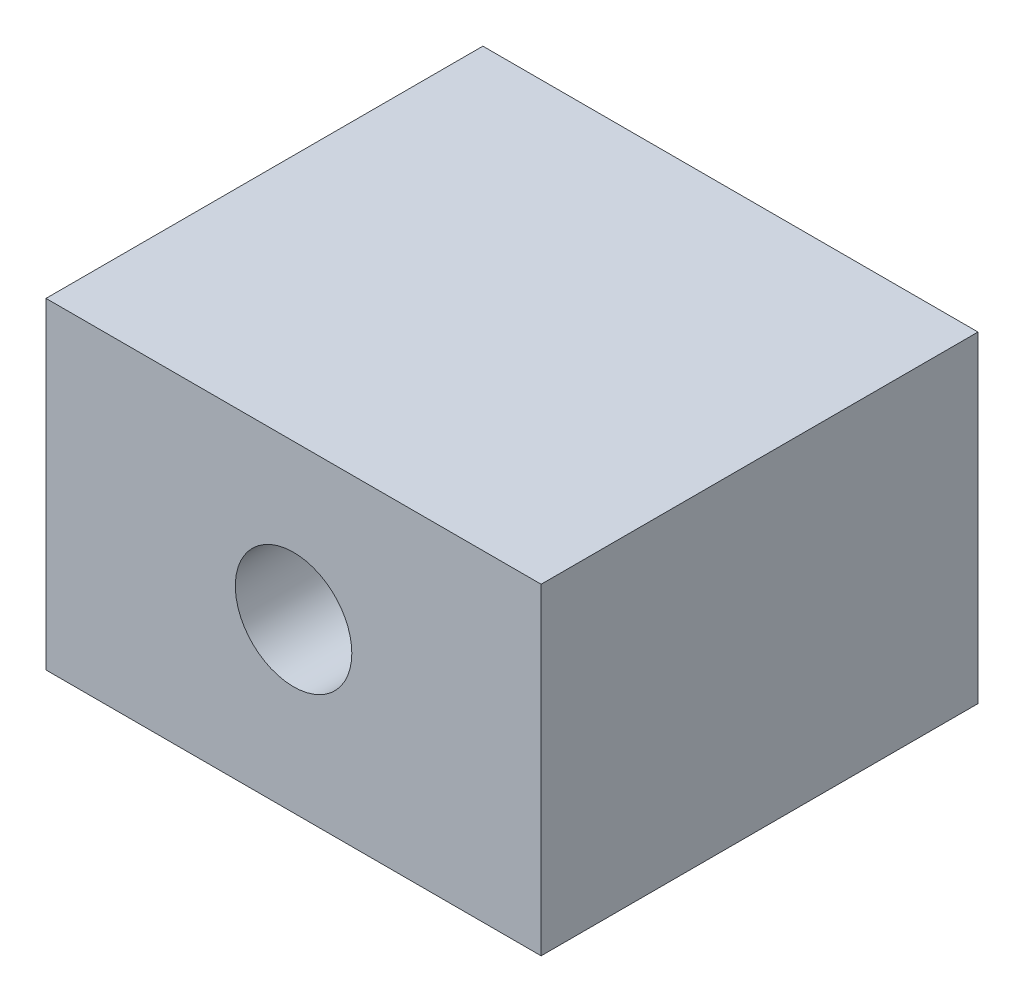
from build123d import *

# Parameters (mm, degrees)
SKETCH1_W           = 34
SKETCH1_H           = 22.1
SKETCH1_R           = 4
BOSS_EXTRUDE1_DEPTH = 30


with BuildPart() as part:
    # Sketch1 → Boss-Extrude1 (new body)
    with BuildSketch(Plane.XY):
        with Locations((17, 11.05)):
            Rectangle(SKETCH1_W, SKETCH1_H)
        with Locations((17, 11.5)):
            Circle(SKETCH1_R, mode=Mode.SUBTRACT)
    extrude(amount=BOSS_EXTRUDE1_DEPTH)


solid = part.part
